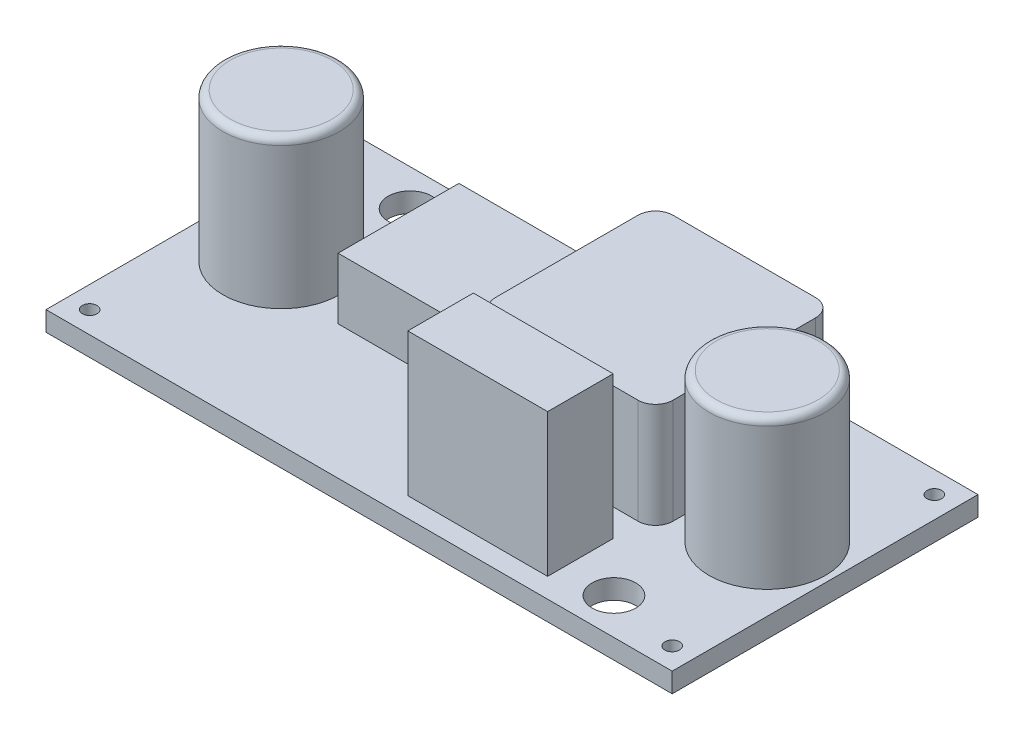
from build123d import *

# Parameters (mm, degrees)
SKETCH2_W             = 43
SKETCH2_H             = 21
SKETCH2_R             = 1.5
BOSS_EXTRUDE1_DEPTH   = 1.35
SKETCH3_R             = 0.5
CUT_EXTRUDE1_DEPTH    = 24.965026601
BOSS_EXTRUDE2_DEPTH   = 7.2
SKETCH6_W             = 9.6
SKETCH6_H             = 4.5
BOSS_EXTRUDE3_DEPTH   = 9.8
SKETCH7_W             = 9.5
SKETCH7_H             = 8.3
BOSS_EXTRUDE4_DEPTH   = 4.2
SKETCH8_R             = 4
BOSS_EXTRUDE5_DEPTH   = 10.2
BOSS_EXTRUDE5_2_DEPTH = 10.2
FILLET1_R             = 0.5
FILLET2_R             = 0.5


with BuildPart() as part:
    # Sketch2 → Boss-Extrude1 (new body)
    with BuildSketch(Plane(origin=(0, 0, 0), x_dir=(1, 0, 0), z_dir=(0, 1, 0))):
        Rectangle(SKETCH2_W, SKETCH2_H)
        with Locations(Location((-15, 8, 0), (0, 0, 90))):
            Circle(SKETCH2_R, mode=Mode.SUBTRACT)
        with Locations(Location((15, -8, 0), (0, 0, 90))):
            Circle(SKETCH2_R, mode=Mode.SUBTRACT)
    extrude(amount=BOSS_EXTRUDE1_DEPTH)

    # Sketch3 → Cut-Extrude1 (cut, through all)
    with BuildSketch(Plane(origin=(0, 1.35, 0), x_dir=(1, 0, 0), z_dir=(0, 1, 0))):
        with Locations(Location((-20, 9, 0), (0, 0, 270))):
            Circle(SKETCH3_R)
        with Locations(Location((20, 9, 0), (0, 0, 90))):
            Circle(SKETCH3_R)
        with Locations(Location((-20, -9, 0), (0, 0, 90))):
            Circle(SKETCH3_R)
        with Locations(Location((20, -9, 0), (0, 0, 270))):
            Circle(SKETCH3_R)
    extrude(amount=-CUT_EXTRUDE1_DEPTH, mode=Mode.SUBTRACT)


with BuildPart() as body_2:
    # Sketch4 → Boss-Extrude2 (new body)
    with BuildSketch(Plane(origin=(0, 1.35, 0), x_dir=(1, 0, 0), z_dir=(0, 1, 0))):
        with BuildLine():
            Line((1.612940952, 9.441476518), (11.412940952, 9.441476518))
            ThreePointArc((11.412940952, 9.441476518), (12.261469089, 9.090004656), (12.612940952, 8.241476518))
            Line((12.612940952, 8.241476518), (12.612940952, -1.558523482))
            ThreePointArc((12.612940952, -1.558523482), (12.261469089, -2.407051619), (11.412940952, -2.758523482))
            Line((11.412940952, -2.758523482), (1.612940952, -2.758523482))
            ThreePointArc((1.612940952, -2.758523482), (0.764412814, -2.407051619), (0.412940952, -1.558523482))
            Line((0.412940952, -1.558523482), (0.412940952, 8.241476518))
            ThreePointArc((0.412940952, 8.241476518), (0.764412814, 9.090004656), (1.612940952, 9.441476518))
        make_face()
    extrude(amount=BOSS_EXTRUDE2_DEPTH)


with BuildPart() as body_3:
    # Sketch6 → Boss-Extrude3 (new body)
    with BuildSketch(Plane(origin=(0, 1.35, 0), x_dir=(1, 0, 0), z_dir=(0, 1, 0))):
        with Locations((6.787914585, -6.892882336)):
            Rectangle(SKETCH6_W, SKETCH6_H)
    extrude(amount=BOSS_EXTRUDE3_DEPTH)


with BuildPart() as body_4:
    # Sketch7 → Boss-Extrude4 (new body)
    with BuildSketch(Plane(origin=(0, 1.35, 0), x_dir=(1, 0, 0), z_dir=(0, 1, 0))):
        with Locations((-5.878194074, 2.834129285)):
            Rectangle(SKETCH7_W, SKETCH7_H)
    extrude(amount=BOSS_EXTRUDE4_DEPTH)


with BuildPart() as body_5:
    # Sketch8 → Boss-Extrude5 (new body)
    with BuildSketch(Plane(origin=(0, 1.35, 0), x_dir=(1, 0, 0), z_dir=(0, 1, 0))):
        with Locations(Location((-16.304990704, 0.454860256, 0), (0, 0, 270))):
            Circle(SKETCH8_R)
    extrude(amount=BOSS_EXTRUDE5_DEPTH)

    # Fillet1
    fillet1_edges = [body_5.edges().sort_by_distance(p)[0] for p in [
        (-16.304990704, 11.55, -4.454860256),
    ]]
    fillet(fillet1_edges, radius=FILLET1_R)


with BuildPart() as body_6:
    # Sketch8 → Boss-Extrude5 2 (new body)
    with BuildSketch(Plane(origin=(0, 1.35, 0), x_dir=(1, 0, 0), z_dir=(0, 1, 0))):
        with Locations(Location((17.074754214, 0.454860256, 0), (0, 0, 270))):
            Circle(SKETCH8_R)
    extrude(amount=BOSS_EXTRUDE5_2_DEPTH)

    # Fillet2
    fillet2_edges = [body_6.edges().sort_by_distance(p)[0] for p in [
        (17.074754214, 11.55, -4.454860256),
    ]]
    fillet(fillet2_edges, radius=FILLET2_R)


solid = Compound([part.part, body_2.part, body_3.part, body_4.part, body_5.part, body_6.part])
